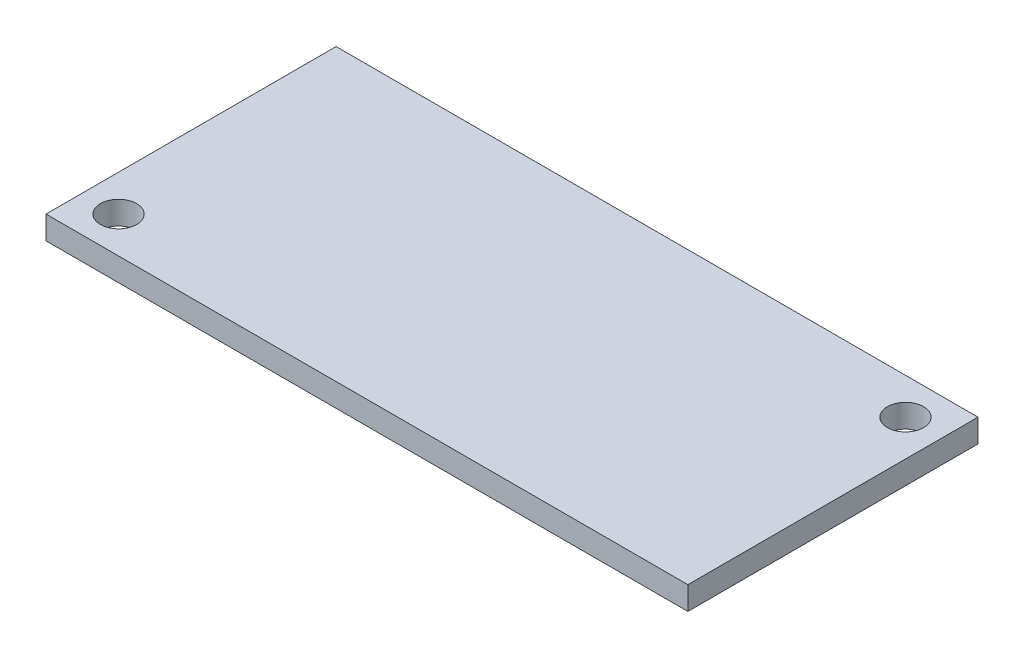
from build123d import *

# Parameters (mm, degrees)
SKETCH1_W           = 44.25
SKETCH1_H           = 20
BOSS_EXTRUDE1_DEPTH = 1.6
SKETCH8_R           = 1.25
CUT_EXTRUDE3_DEPTH  = 25.332604156


with BuildPart() as part:
    # Sketch1 → Boss-Extrude1 (new body)
    with BuildSketch(Plane(origin=(0, 0, 0), x_dir=(1, 0, 0), z_dir=(0, 1, 0))):
        Rectangle(SKETCH1_W, SKETCH1_H)
    extrude(amount=BOSS_EXTRUDE1_DEPTH)

    # Sketch8 → Cut-Extrude3 (cut, through all)
    with BuildSketch(Plane(origin=(0, 1.6, 0), x_dir=(1, 0, 0), z_dir=(0, 1, 0))):
        with Locations(Location((-19.625, -7.5, 0), (0, 0, 270))):
            Circle(SKETCH8_R)
        with Locations(Location((19.625, 7.5, 0), (0, 0, 270))):
            Circle(SKETCH8_R)
    extrude(amount=-CUT_EXTRUDE3_DEPTH, mode=Mode.SUBTRACT)


solid = part.part
